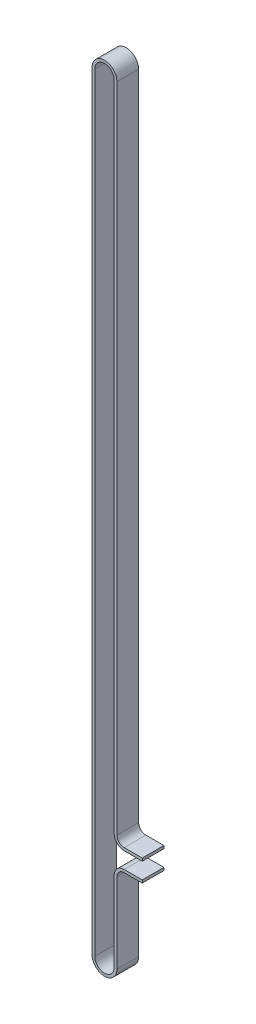
from build123d import *

# Parameters (mm, degrees)
EXTRUDE_THIN1_DEPTH = 12


with BuildPart() as part:
    # Sketch1 → Extrude-Thin1 (new body)
    with BuildSketch(Plane.XY):
        with BuildLine():
            Line((20.881, -364.8), (10.881, -364.8))
            ThreePointArc((10.881, -364.8), (8.052572875, -363.628427125), (6.881, -360.8))
            Line((6.881, -360.8), (6.881, 0))
            ThreePointArc((6.881, 0), (0, 6.881), (-6.881, 0))
            Line((-6.881, 0), (-6.881, -425))
            ThreePointArc((-6.881, -425), (0, -431.881), (6.881, -425))
            Line((6.881, -425), (6.881, -380.8))
            ThreePointArc((6.881, -380.8), (8.052572875, -377.971572875), (10.881, -376.8))
            Line((10.881, -376.8), (20.881, -376.8))
            Line((20.881, -376.8), (20.881, -375.28))
            Line((20.881, -375.28), (10.881, -375.28))
            ThreePointArc((10.881, -375.28), (6.977770568, -376.896770568), (5.361, -380.8))
            Line((5.361, -380.8), (5.361, -425))
            ThreePointArc((5.361, -425), (0, -430.361), (-5.361, -425))
            Line((-5.361, -425), (-5.361, 0))
            ThreePointArc((-5.361, 0), (0, 5.361), (5.361, 0))
            Line((5.361, 0), (5.361, -360.8))
            ThreePointArc((5.361, -360.8), (6.977770568, -364.703229432), (10.881, -366.32))
            Line((10.881, -366.32), (20.881, -366.32))
            Line((20.881, -366.32), (20.881, -364.8))
        make_face()
    extrude(amount=EXTRUDE_THIN1_DEPTH)


solid = part.part
